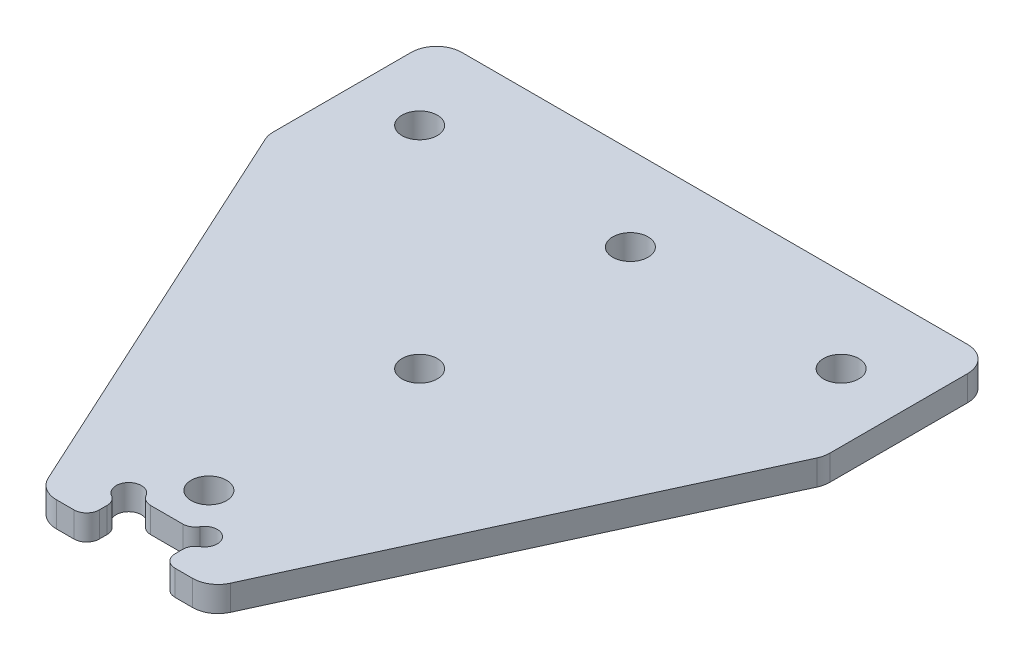
from build123d import *

# Parameters (mm, degrees)
SKETCH_1_R          = 2.1
EXTRUDE_1_DEPTH     = 3
FILLET_1_R          = 3
SKETCH_2_W          = 9
SKETCH_2_H          = 5
CUT_EXTRUDE_1_DEPTH = 3
SKETCH_3_R          = 1.5
CUT_EXTRUDE_2_DEPTH = 10
FILLET_2_R          = 1.5


with BuildPart() as part:
    # 草图1 → 凸台-拉伸1 (new body)
    with BuildSketch(Plane(origin=(0, 0, 0), x_dir=(1, 0, 0), z_dir=(0, 1, 0))):
        Polygon((33, 10), (-33, 10), (-33, -10), (-10, -60), (10, -60), (33, -10), align=None)
        with Locations(Location((0, 0, 0), (0, 0, 270))):
            Circle(SKETCH_1_R, mode=Mode.SUBTRACT)
        with Locations(Location((25, 0, 0), (0, 0, 270))):
            Circle(SKETCH_1_R, mode=Mode.SUBTRACT)
        with Locations(Location((-25, 0, 0), (0, 0, 270))):
            Circle(SKETCH_1_R, mode=Mode.SUBTRACT)
        with Locations(Location((0, -25, 0), (0, 0, 270))):
            Circle(SKETCH_1_R, mode=Mode.SUBTRACT)
        with Locations(Location((0, -50, 0), (0, 0, 270))):
            Circle(SKETCH_1_R, mode=Mode.SUBTRACT)
    extrude(amount=EXTRUDE_1_DEPTH)

    # 圆角1
    fillet_1_edges = [part.edges().sort_by_distance(p)[0] for p in [
        (10, 1.5, 60),
        (-10, 1.5, 60),
        (-33, 1.5, 10),
        (-33, 1.5, -10),
        (33, 1.5, -10),
        (33, 1.5, 10),
    ]]
    fillet(fillet_1_edges, radius=FILLET_1_R)

    # 草图2 → 切除-拉伸1 (cut)
    with BuildSketch(Plane(origin=(0, 3, 0), x_dir=(1, 0, 0), z_dir=(0, 1, 0))):
        with Locations((0, -57.5)):
            Rectangle(SKETCH_2_W, SKETCH_2_H)
    extrude(amount=-CUT_EXTRUDE_1_DEPTH, mode=Mode.SUBTRACT)

    # 草图3 → 切除-拉伸2 (cut)
    with BuildSketch(Plane(origin=(0, 3, 0), x_dir=(1, 0, 0), z_dir=(0, 1, 0))):
        with Locations((-4.5, -55)):
            Circle(SKETCH_3_R)
        with Locations((4.5, -55)):
            Circle(SKETCH_3_R)
    extrude(amount=-CUT_EXTRUDE_2_DEPTH, mode=Mode.SUBTRACT)

    # 圆角2
    fillet_2_edges = [part.edges().sort_by_distance(p)[0] for p in [
        (-4.5, 1.5, 56.5),
        (3, 1.5, 55),
        (-4.5, 1.5, 60),
        (4.5, 1.5, 60),
        (4.5, 1.5, 56.5),
        (-3, 1.5, 55),
    ]]
    fillet(fillet_2_edges, radius=FILLET_2_R)


solid = part.part
